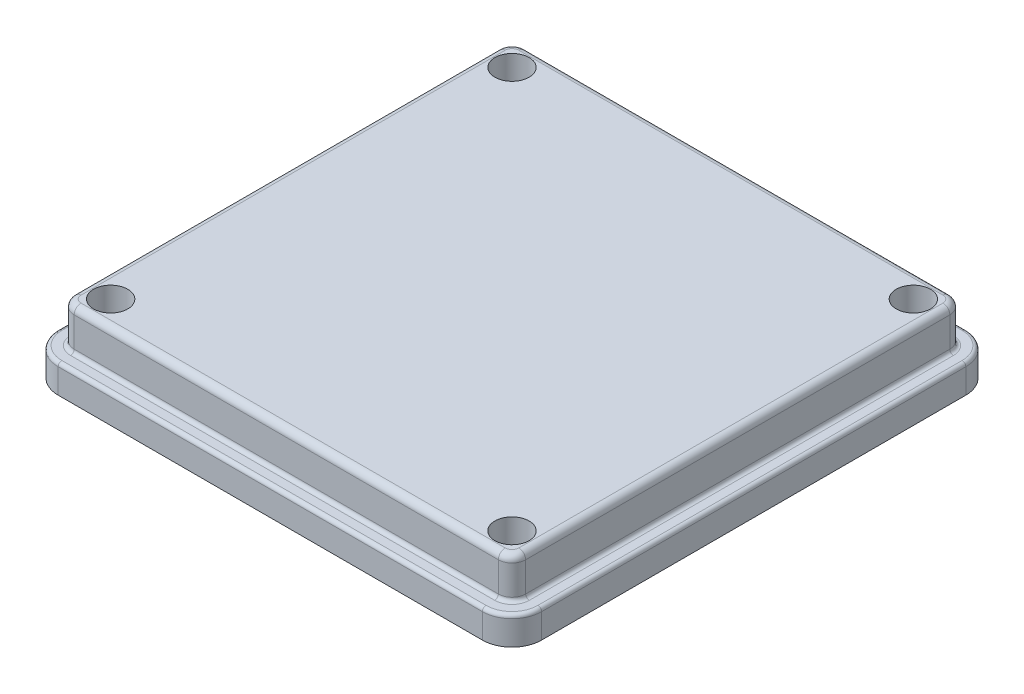
from build123d import *

# Parameters (mm, degrees)
BOSS_EXTRUDE1_DEPTH                     = 15
FILLET1_R                               = 1.5
SHELL1_T                                = -2
BOSS_EXTRUDE2_DEPTH                     = 6.2
CUT_EXTRUDE1_DEPTH                      = 5
FILLET2_R                               = 0.8
BOSS_EXTRUDE4_START                     = -1
SKETCH4_R                               = 5
BOSS_EXTRUDE4_DEPTH                     = 14
CBORE_FOR_M5_HEX_HEAD_BOLT1_D           = 3.7
CBORE_FOR_M5_HEX_HEAD_BOLT1_CBORE_D     = 7.5
CBORE_FOR_M5_HEX_HEAD_BOLT1_CBORE_DEPTH = 12


with BuildPart() as part:
    # Sketch1 → Boss-Extrude1 (new body)
    with BuildSketch(Plane(origin=(0, 0, 0), x_dir=(1, 0, 0), z_dir=(0, 1, 0))):
        with BuildLine():
            Line((49.5, -46.5), (49.5, 46.5))
            ThreePointArc((49.5, 46.5), (48.621320344, 48.621320344), (46.5, 49.5))
            Line((46.5, 49.5), (-46.5, 49.5))
            ThreePointArc((-46.5, 49.5), (-48.621320344, 48.621320344), (-49.5, 46.5))
            Line((-49.5, 46.5), (-49.5, -46.5))
            ThreePointArc((-49.5, -46.5), (-48.621320344, -48.621320344), (-46.5, -49.5))
            Line((-46.5, -49.5), (46.5, -49.5))
            ThreePointArc((46.5, -49.5), (48.621320344, -48.621320344), (49.5, -46.5))
        make_face()
    extrude(amount=BOSS_EXTRUDE1_DEPTH)

    # Fillet1
    fillet1_edges = [part.edges().sort_by_distance(p)[0] for p in [
        (-48.621320344, 15, -48.621320344),
        (-49.5, 15, 0),
        (-48.621320344, 15, 48.621320344),
        (0, 15, 49.5),
        (48.621320344, 15, 48.621320344),
        (49.5, 15, 0),
        (48.621320344, 15, -48.621320344),
        (0, 15, -49.5),
    ]]
    fillet(fillet1_edges, radius=FILLET1_R)

    # Shell1
    shell1_openings = [part.faces().sort_by_distance(p)[0] for p in [
        (0, 0, 0),
    ]]
    offset(amount=SHELL1_T, openings=shell1_openings, kind=Kind.INTERSECTION)

    # Sketch2 → Boss-Extrude2 (add)
    with BuildSketch(Plane(origin=(0, 0, 0), x_dir=(1, 0, 0), z_dir=(0, 1, 0))):
        with BuildLine():
            Line((-53, 46.5), (-53, -46.5))
            ThreePointArc((-53, -46.5), (-51.096194078, -51.096194078), (-46.5, -53))
            Line((-46.5, -53), (46.5, -53))
            ThreePointArc((46.5, -53), (51.096194078, -51.096194078), (53, -46.5))
            Line((53, -46.5), (53, 46.5))
            ThreePointArc((53, 46.5), (51.096194078, 51.096194078), (46.5, 53))
            Line((46.5, 53), (-46.5, 53))
            ThreePointArc((-46.5, 53), (-51.096194078, 51.096194078), (-53, 46.5))
        make_face()
        with BuildLine():
            Line((47.5, -46.5), (47.5, 46.5))
            ThreePointArc((47.5, 46.5), (47.207106781, 47.207106781), (46.5, 47.5))
            Line((46.5, 47.5), (-46.5, 47.5))
            ThreePointArc((-46.5, 47.5), (-47.207106781, 47.207106781), (-47.5, 46.5))
            Line((-47.5, 46.5), (-47.5, -46.5))
            ThreePointArc((-47.5, -46.5), (-47.207106781, -47.207106781), (-46.5, -47.5))
            Line((-46.5, -47.5), (46.5, -47.5))
            ThreePointArc((46.5, -47.5), (47.207106781, -47.207106781), (47.5, -46.5))
        make_face(mode=Mode.SUBTRACT)
    extrude(amount=BOSS_EXTRUDE2_DEPTH)

    # Sketch3 → Cut-Extrude1 (cut)
    with BuildSketch(Plane.XZ):
        with BuildLine():
            Line((-46.5, -51.5), (46.5, -51.5))
            ThreePointArc((46.5, -51.5), (50.035533906, -50.035533906), (51.5, -46.5))
            Line((51.5, -46.5), (51.5, 46.5))
            ThreePointArc((51.5, 46.5), (50.035533906, 50.035533906), (46.5, 51.5))
            Line((46.5, 51.5), (-46.5, 51.5))
            ThreePointArc((-46.5, 51.5), (-50.035533906, 50.035533906), (-51.5, 46.5))
            Line((-51.5, 46.5), (-51.5, -46.5))
            ThreePointArc((-51.5, -46.5), (-50.035533906, -50.035533906), (-46.5, -51.5))
        make_face()
        with BuildLine():
            Line((49, -46.5), (49, 46.5))
            ThreePointArc((49, 46.5), (48.267766953, 48.267766953), (46.5, 49))
            Line((46.5, 49), (-46.5, 49))
            ThreePointArc((-46.5, 49), (-48.267766953, 48.267766953), (-49, 46.5))
            Line((-49, 46.5), (-49, -46.5))
            ThreePointArc((-49, -46.5), (-48.267766953, -48.267766953), (-46.5, -49))
            Line((-46.5, -49), (46.5, -49))
            ThreePointArc((46.5, -49), (48.267766953, -48.267766953), (49, -46.5))
        make_face(mode=Mode.SUBTRACT)
    extrude(amount=-CUT_EXTRUDE1_DEPTH, mode=Mode.SUBTRACT)

    # Fillet2
    fillet2_edges = [part.edges().sort_by_distance(p)[0] for p in [
        (-51.096194078, 6.2, -51.096194078),
        (-53, 6.2, 0),
        (-51.096194078, 6.2, 51.096194078),
        (0, 6.2, 53),
        (51.096194078, 6.2, 51.096194078),
        (53, 6.2, 0),
        (51.096194078, 6.2, -51.096194078),
        (0, 6.2, -53),
        (49.5, 6.2, 0),
        (48.621320344, 6.2, -48.621320344),
        (0, 6.2, -49.5),
        (-48.621320344, 6.2, -48.621320344),
        (-49.5, 6.2, 0),
        (-48.621320344, 6.2, 48.621320344),
        (0, 6.2, 49.5),
        (48.621320344, 6.2, 48.621320344),
    ]]
    fillet(fillet2_edges, radius=FILLET2_R)

    # Sketch4 → Boss-Extrude4 (add)
    with BuildSketch(Plane(origin=(0, 15, 0), x_dir=(1, 0, 0), z_dir=(0, 1, 0)).offset(BOSS_EXTRUDE4_START)):
        with Locations((44, 44)):
            Circle(SKETCH4_R)
        with Locations((44, -44)):
            Circle(SKETCH4_R)
        with Locations((-44, 44)):
            Circle(SKETCH4_R)
        with Locations((-44, -44)):
            Circle(SKETCH4_R)
    extrude(amount=-BOSS_EXTRUDE4_DEPTH)

    # CBORE for M5 Hex Head Bolt1 (through all)
    with Locations(Plane(origin=(0, 15, 0), x_dir=(1, 0, 0), z_dir=(0, 1, 0))):
        with Locations((-44, -44), (44, -44), (-44, 44), (44, 44)):
            CounterBoreHole(CBORE_FOR_M5_HEX_HEAD_BOLT1_D / 2, CBORE_FOR_M5_HEX_HEAD_BOLT1_CBORE_D / 2, CBORE_FOR_M5_HEX_HEAD_BOLT1_CBORE_DEPTH)


solid = part.part
